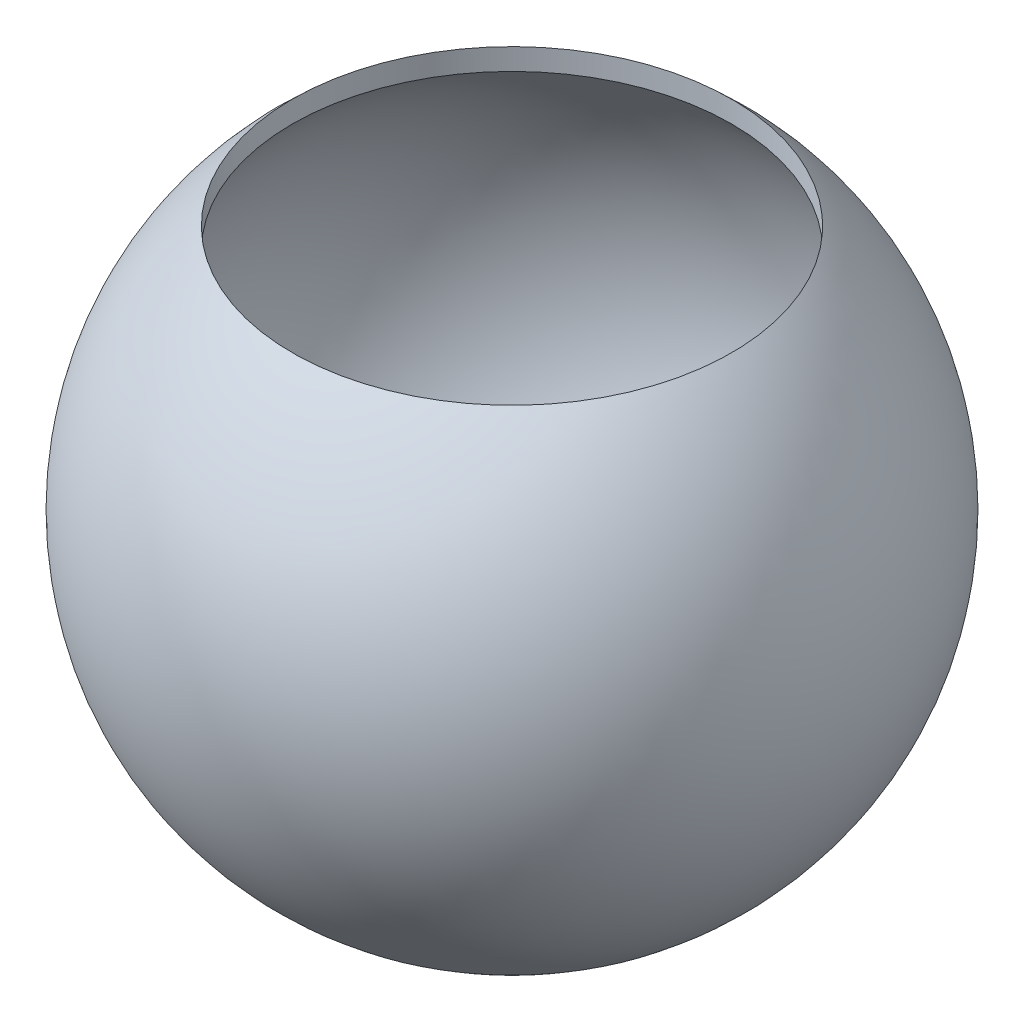
from build123d import *

# Parameters (mm, degrees)
SKETCH_2_R          = 7
CUT_EXTRUDE_1_DEPTH = 10
SKETCH_5_R          = 2.5
CUT_EXTRUDE_3_DEPTH = 10
CUT_EXTRUDE_START   = -10
SKETCH_6_R          = 2.5
CUT_EXTRUDE_4_DEPTH = 10


with BuildPart() as part:
    # 草图1 → 旋转1 (revolve)
    with BuildSketch(Plane.XY):
        with BuildLine():
            Line((0, -10.5), (0, -10))
            ThreePointArc((0, -10), (10, 0), (0, 10))
            Line((0, 10), (0, 10.5))
            ThreePointArc((0, 10.5), (10.5, 0), (0, -10.5))
        make_face()
    revolve(axis=Axis((0, 10, 0), (0, 1, 0)))

    # 草图2 → 切除-拉伸1 (cut)
    with BuildSketch(Plane(origin=(0, 10.5, 0), x_dir=(1, 0, 0), z_dir=(0, 1, 0))):
        with Locations(Location((0, 0, 0), (0, 0, 90))):
            Circle(SKETCH_2_R)
    extrude(amount=-CUT_EXTRUDE_1_DEPTH, mode=Mode.SUBTRACT)

    # 草图5 → 切除-拉伸3 (cut)
    with BuildSketch(Plane(origin=(0, -9.933965028, 0), x_dir=(1, 0, 0), z_dir=(0, 1, 0))):
        Circle(SKETCH_5_R)
    extrude(amount=CUT_EXTRUDE_3_DEPTH, mode=Mode.SUBTRACT)

    # 草图6 → 切除-拉伸4 (cut)
    with BuildSketch(Plane(origin=(0, -9.933965028, 0), x_dir=(1, 0, 0), z_dir=(0, 1, 0)).offset(CUT_EXTRUDE_START)):
        Circle(SKETCH_6_R)
    extrude(amount=CUT_EXTRUDE_4_DEPTH, mode=Mode.SUBTRACT)


solid = part.part
